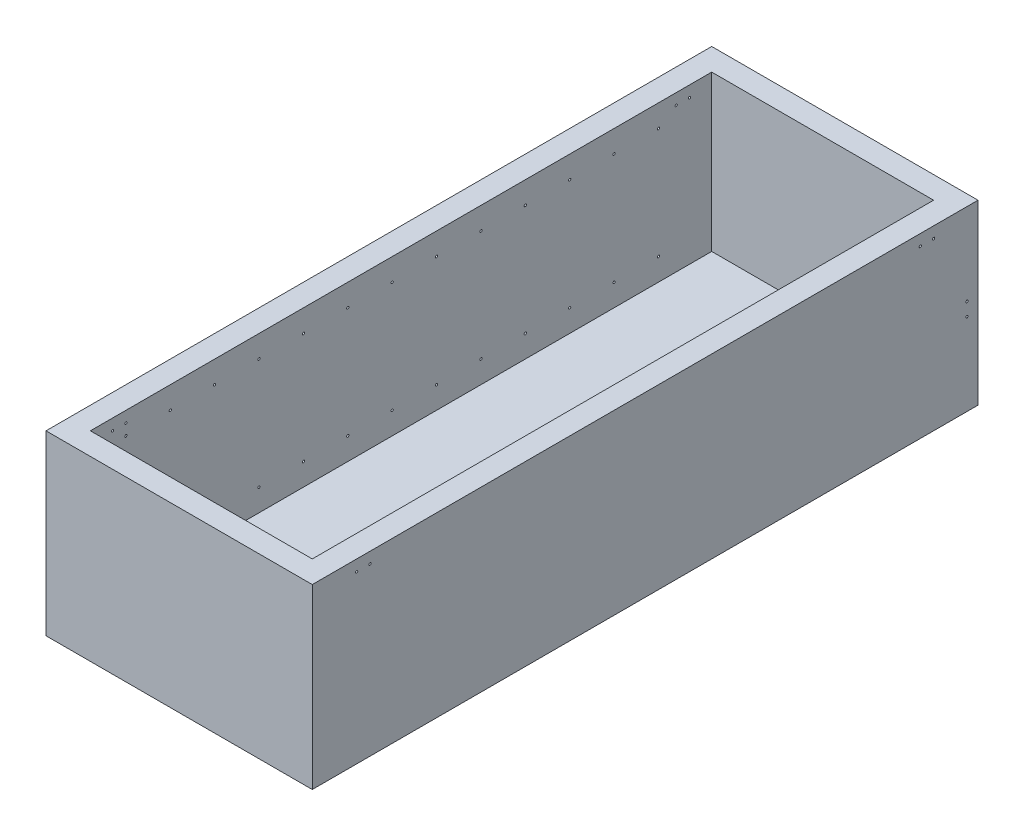
from build123d import *

# Parameters (mm, degrees)
SKETCH1_W           = 600
SKETCH1_H           = 1500
BOSS_EXTRUDE1_DEPTH = 400
SHELL1_T            = -50
SKETCH2_R           = 2.5
CUT_EXTRUDE1_DEPTH  = 1041.432602334
SKETCH13_R          = 2.5
CUT_EXTRUDE2_DEPTH  = 275
LPATTERN1_COUNT     = 13
LPATTERN1_PITCH     = 100
SKETCH14_R          = 2.5
CUT_EXTRUDE3_DEPTH  = 25


with BuildPart() as part:
    # Sketch1 → Boss-Extrude1 (new body)
    with BuildSketch(Plane(origin=(0, 0, 0), x_dir=(1, 0, 0), z_dir=(0, 1, 0))):
        Rectangle(SKETCH1_W, SKETCH1_H)
    extrude(amount=BOSS_EXTRUDE1_DEPTH)

    # Shell1
    shell1_openings = [part.faces().sort_by_distance(p)[0] for p in [
        (0, 400, 0),
    ]]
    offset(amount=SHELL1_T, openings=shell1_openings, kind=Kind.INTERSECTION)

    # Sketch2 → Cut-Extrude1 (cut, through all)
    with BuildSketch(Plane(origin=(300, 0, 0), x_dir=(0, 0, -1), z_dir=(1, 0, 0))):
        with Locations((-650, 375)):
            Circle(SKETCH2_R)
        with Locations((-620, 375)):
            Circle(SKETCH2_R)
        with Locations((650, 375)):
            Circle(SKETCH2_R)
        with Locations((620, 375)):
            Circle(SKETCH2_R)
    extrude(amount=-CUT_EXTRUDE1_DEPTH, mode=Mode.SUBTRACT)

    # Sketch13 → Cut-Extrude2 (cut, symmetric)
    with BuildSketch(Plane(origin=(0, 0, 0), x_dir=(0, 0, -1), z_dir=(1, 0, 0))):
        with Locations((-620, 350)):
            Circle(SKETCH13_R)
        with Locations((-620, 100)):
            Circle(SKETCH13_R)
    cut_extrude2 = extrude(amount=CUT_EXTRUDE2_DEPTH, both=True, mode=Mode.SUBTRACT)

    # LPattern1: Cut-Extrude2 ×13
    with Locations(*[(0, 0, -i * LPATTERN1_PITCH) for i in range(1, LPATTERN1_COUNT)]):
        add(cut_extrude2, mode=Mode.SUBTRACT)

    # Sketch14 → Cut-Extrude3 (cut)
    with BuildSketch(Plane(origin=(300, 0, 0), x_dir=(0, 0, -1), z_dir=(1, 0, 0))):
        with Locations((725, 215)):
            Circle(SKETCH14_R)
        with Locations((725, 185)):
            Circle(SKETCH14_R)
    cut_extrude3 = extrude(amount=-CUT_EXTRUDE3_DEPTH, mode=Mode.SUBTRACT)

    # Mirror1: Cut-Extrude3 across plane
    add(cut_extrude3.mirror(Plane(origin=(0, 0, 0), x_dir=(0, 0, 1), z_dir=(1, 0, 0))), mode=Mode.SUBTRACT)


solid = part.part
